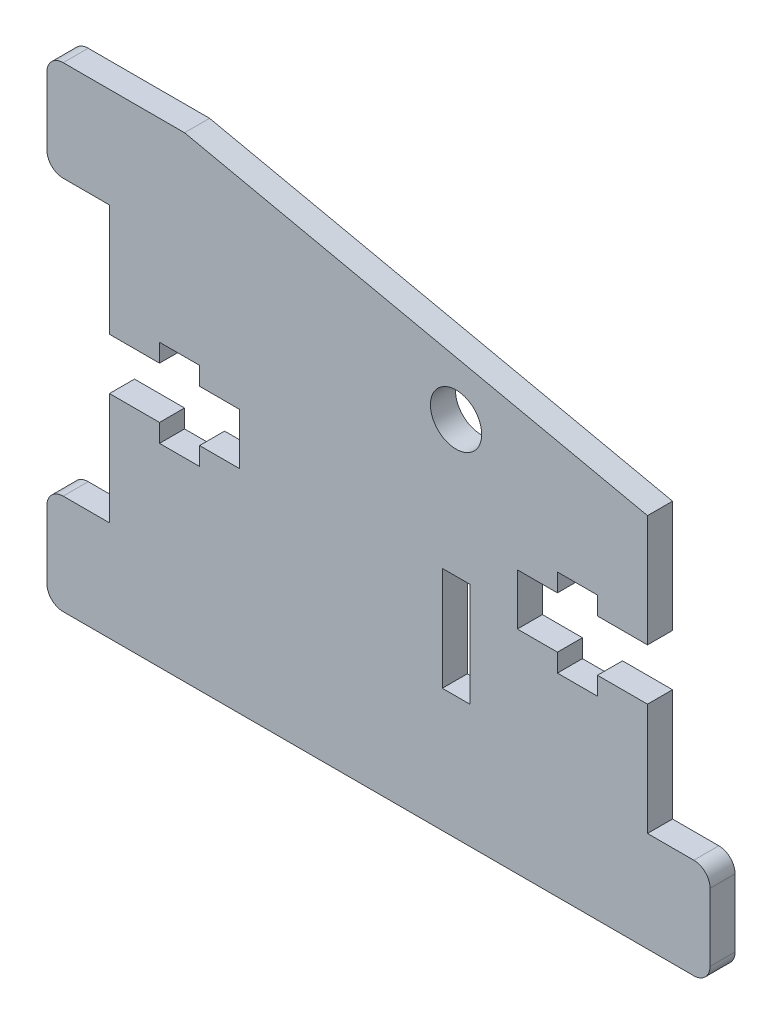
from build123d import *

# Parameters (mm, degrees)
SKETCH_1_R      = 2.05
SKETCH_1_W      = 2.2
SKETCH_1_H      = 8.3
EXTRUDE_1_DEPTH = 2
FILLET_1_R      = 1.3


with BuildPart() as part:
    # 草图1 → 凸台-拉伸1 (new body)
    with BuildSketch(Plane.XY):
        Polygon((-35.523848217, 30.239854129), (-30.523848217, 30.239854129), (12.476151783, 30.239854129), (17.476151783, 30.239854129), (17.476151783, 38.239854129), (12.476151783, 38.239854129), (12.476151783, 47.189854129), (8.476151783, 47.189854129), (8.476151783, 45.739854129), (5.276151783, 45.739854129), (5.276151783, 47.189854129), (2.076151783, 47.189854129), (2.076151783, 51.289854129), (5.276151783, 51.289854129), (5.276151783, 52.739854129), (8.476151783, 52.739854129), (8.476151783, 51.289854129), (12.476151783, 51.289854129), (12.476151783, 60.239854129), (-24.523824953, 68.239854129), (-30.523848217, 68.239854129), (-35.523848217, 68.239854129), (-35.523848217, 60.239854129), (-30.523848217, 60.239854129), (-30.523848217, 51.289854129), (-26.523848217, 51.289854129), (-26.523848217, 52.739854129), (-23.323848217, 52.739854129), (-23.323848217, 51.289854129), (-20.123848217, 51.289854129), (-20.123848217, 47.189854129), (-23.323848217, 47.189854129), (-23.323848217, 45.739854129), (-26.523848217, 45.739854129), (-26.523848217, 47.189854129), (-30.523848217, 47.189854129), (-30.523848217, 38.239854129), (-35.523848217, 38.239854129), align=None)
        with Locations((-2.823848217, 59.239854129)):
            Circle(SKETCH_1_R, mode=Mode.SUBTRACT)
        with Locations((-2.823848217, 44.239854129)):
            Rectangle(SKETCH_1_W, SKETCH_1_H, mode=Mode.SUBTRACT)
    extrude(amount=EXTRUDE_1_DEPTH)

    # 圆角1
    fillet_1_edges = [part.edges().sort_by_distance(p)[0] for p in [
        (-35.523848217, 60.239854129, 1),
        (-35.523848217, 68.239854129, 1),
        (17.476151783, 38.239854129, 1),
        (17.476151783, 30.239854129, 1),
        (-35.523848217, 30.239854129, 1),
        (-35.523848217, 38.239854129, 1),
    ]]
    fillet(fillet_1_edges, radius=FILLET_1_R)


solid = part.part
